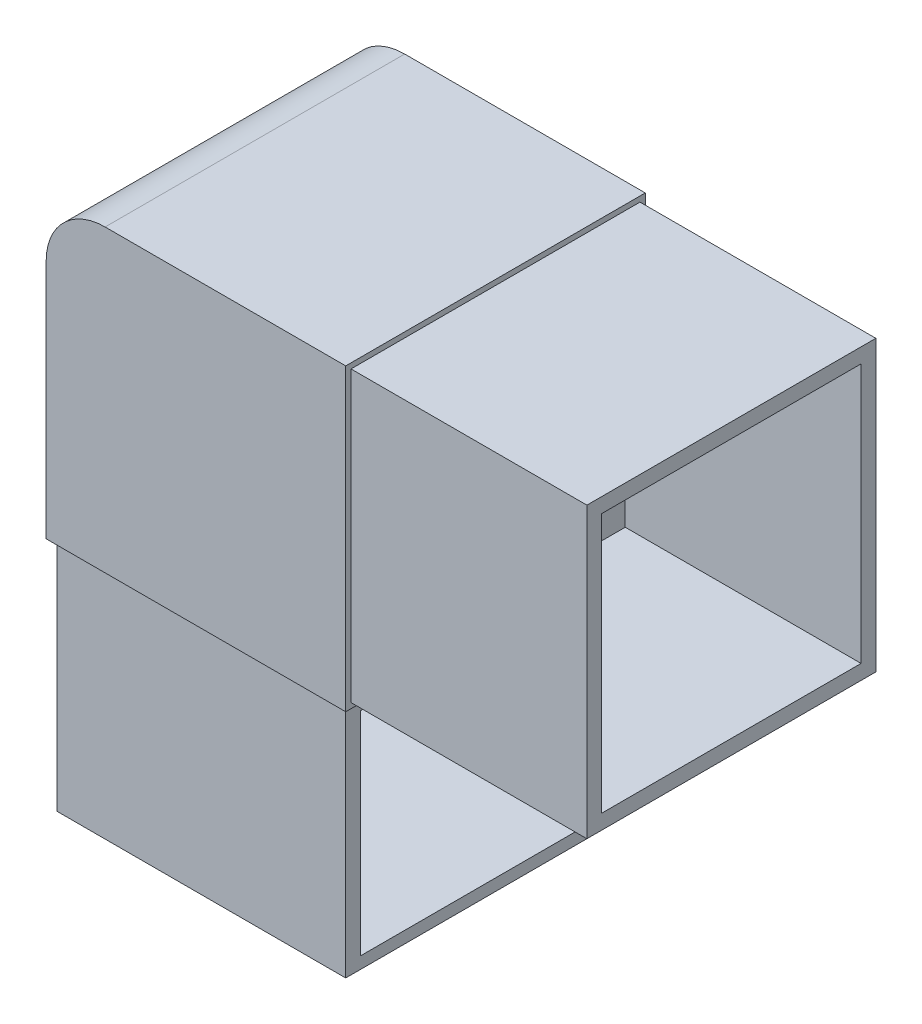
from build123d import *

# Parameters (mm, degrees)
SKETCH1_W           = 25.4
SKETCH1_H           = 25.4
BOSS_EXTRUDE1_DEPTH = 25.4
FILLET1_R           = 5
SKETCH2_W           = 24.5
SKETCH2_H           = 24.5
BOSS_EXTRUDE2_DEPTH = 20
SKETCH3_W           = 22
SKETCH3_H           = 22
CUT_EXTRUDE1_DEPTH  = 20
SKETCH4_W           = 24.5
SKETCH4_H           = 24.5
BOSS_EXTRUDE3_DEPTH = 20
SKETCH5_W           = 22
SKETCH5_H           = 18
CUT_EXTRUDE2_DEPTH  = 23


with BuildPart() as part:
    # Sketch1 → Boss-Extrude1 (new body)
    with BuildSketch(Plane(origin=(0, 0, 0), x_dir=(1, 0, 0), z_dir=(0, 1, 0))):
        Rectangle(SKETCH1_W, SKETCH1_H)
    extrude(amount=BOSS_EXTRUDE1_DEPTH)

    # Fillet1
    fillet1_edges = [part.edges().sort_by_distance(p)[0] for p in [
        (-12.7, 25.4, 0),
    ]]
    fillet(fillet1_edges, radius=FILLET1_R)

    # Sketch2 → Boss-Extrude2 (add)
    with BuildSketch(Plane(origin=(12.7, 0, 0), x_dir=(0, 0, -1), z_dir=(1, 0, 0))):
        with Locations((0, 12.7)):
            Rectangle(SKETCH2_W, SKETCH2_H)
    extrude(amount=BOSS_EXTRUDE2_DEPTH)

    # Sketch3 → Cut-Extrude1 (cut)
    with BuildSketch(Plane(origin=(32.7, 0, 0), x_dir=(0, 0, -1), z_dir=(1, 0, 0))):
        with Locations((0, 12.7)):
            Rectangle(SKETCH3_W, SKETCH3_H)
    extrude(amount=-CUT_EXTRUDE1_DEPTH, mode=Mode.SUBTRACT)

    # Sketch4 → Boss-Extrude3 (add)
    with BuildSketch(Plane.XZ):
        Rectangle(SKETCH4_W, SKETCH4_H)
    extrude(amount=BOSS_EXTRUDE3_DEPTH)

    # Sketch5 → Cut-Extrude2 (cut)
    with BuildSketch(Plane(origin=(12.25, 0, 0), x_dir=(0, 0, -1), z_dir=(1, 0, 0))):
        with Locations((0, -10)):
            Rectangle(SKETCH5_W, SKETCH5_H)
    extrude(amount=-CUT_EXTRUDE2_DEPTH, mode=Mode.SUBTRACT)


solid = part.part
